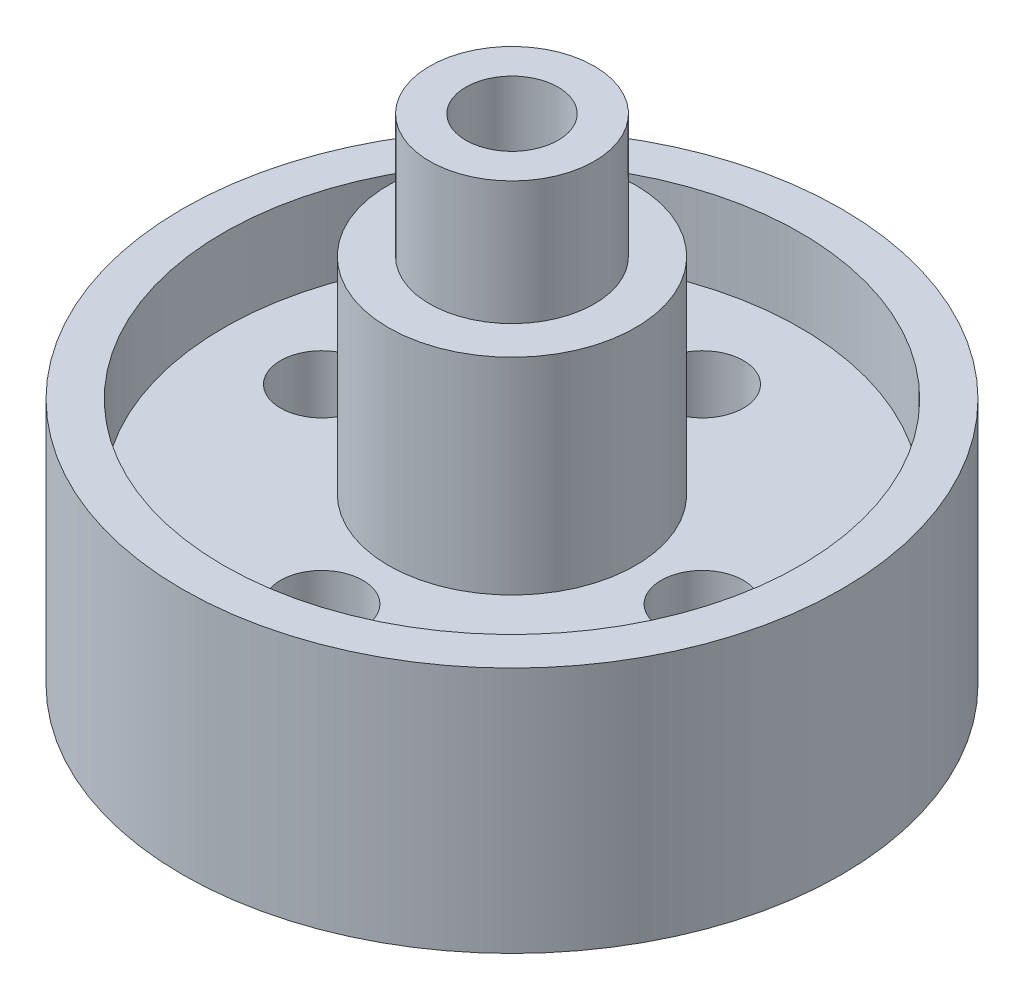
from build123d import *

# Parameters (mm, degrees)
SKETCH1_R           = 50.8
BOSS_EXTRUDE1_DEPTH = 25.4
SKETCH2_R           = 6.35
CUT_EXTRUDE1_DEPTH  = 25.4
SKETCH3_R           = 50.8
SKETCH3_R_2         = 44.45
BOSS_EXTRUDE2_DEPTH = 12.7
SKETCH5_R           = 19.05
BOSS_EXTRUDE3_DEPTH = 31.75
SKETCH6_R           = 12.7
BOSS_EXTRUDE4_DEPTH = 19.05
SKETCH7_R           = 7.112
CUT_EXTRUDE2_DEPTH  = 105.726882891


with BuildPart() as part:
    # Sketch1 → Boss-Extrude1 (new body)
    with BuildSketch(Plane(origin=(0, 0, 0), x_dir=(1, 0, 0), z_dir=(0, 1, 0))):
        with Locations(Location((0, 0, 0), (0, 0, 270))):
            Circle(SKETCH1_R)
    extrude(amount=BOSS_EXTRUDE1_DEPTH)

    # Sketch2 → Cut-Extrude1 (cut)
    with BuildSketch(Plane(origin=(0, 25.4, 0), x_dir=(1, 0, 0), z_dir=(0, 1, 0))):
        with Locations(Location((-29.337, 0, 0), (0, 0, 270))):
            Circle(SKETCH2_R)
        with Locations(Location((0, 29.337, 0), (0, 0, 270))):
            Circle(SKETCH2_R)
        with Locations(Location((29.337, 0, 0), (0, 0, 270))):
            Circle(SKETCH2_R)
        with Locations(Location((0, -29.337, 0), (0, 0, 270))):
            Circle(SKETCH2_R)
    extrude(amount=-CUT_EXTRUDE1_DEPTH, mode=Mode.SUBTRACT)

    # Sketch3 → Boss-Extrude2 (add)
    with BuildSketch(Plane(origin=(0, 25.4, 0), x_dir=(1, 0, 0), z_dir=(0, 1, 0))):
        with Locations(Location((0, 0, 0), (0, 0, 270))):
            Circle(SKETCH3_R)
        with Locations(Location((0, 0, 0), (0, 0, 270))):
            Circle(SKETCH3_R_2, mode=Mode.SUBTRACT)
    extrude(amount=BOSS_EXTRUDE2_DEPTH)

    # Sketch5 → Boss-Extrude3 (add)
    with BuildSketch(Plane(origin=(0, 25.4, 0), x_dir=(1, 0, 0), z_dir=(0, 1, 0))):
        with Locations(Location((0, 0, 0), (0, 0, 270))):
            Circle(SKETCH5_R)
    extrude(amount=BOSS_EXTRUDE3_DEPTH)

    # Sketch6 → Boss-Extrude4 (add)
    with BuildSketch(Plane(origin=(0, 57.15, 0), x_dir=(1, 0, 0), z_dir=(0, 1, 0))):
        with Locations(Location((0, 0, 0), (0, 0, 90))):
            Circle(SKETCH6_R)
    extrude(amount=BOSS_EXTRUDE4_DEPTH)

    # Sketch7 → Cut-Extrude2 (cut, through all)
    with BuildSketch(Plane(origin=(0, 76.2, 0), x_dir=(1, 0, 0), z_dir=(0, 1, 0))):
        with Locations(Location((0, 0, 0), (0, 0, 270))):
            Circle(SKETCH7_R)
    extrude(amount=-CUT_EXTRUDE2_DEPTH, mode=Mode.SUBTRACT)


solid = part.part
